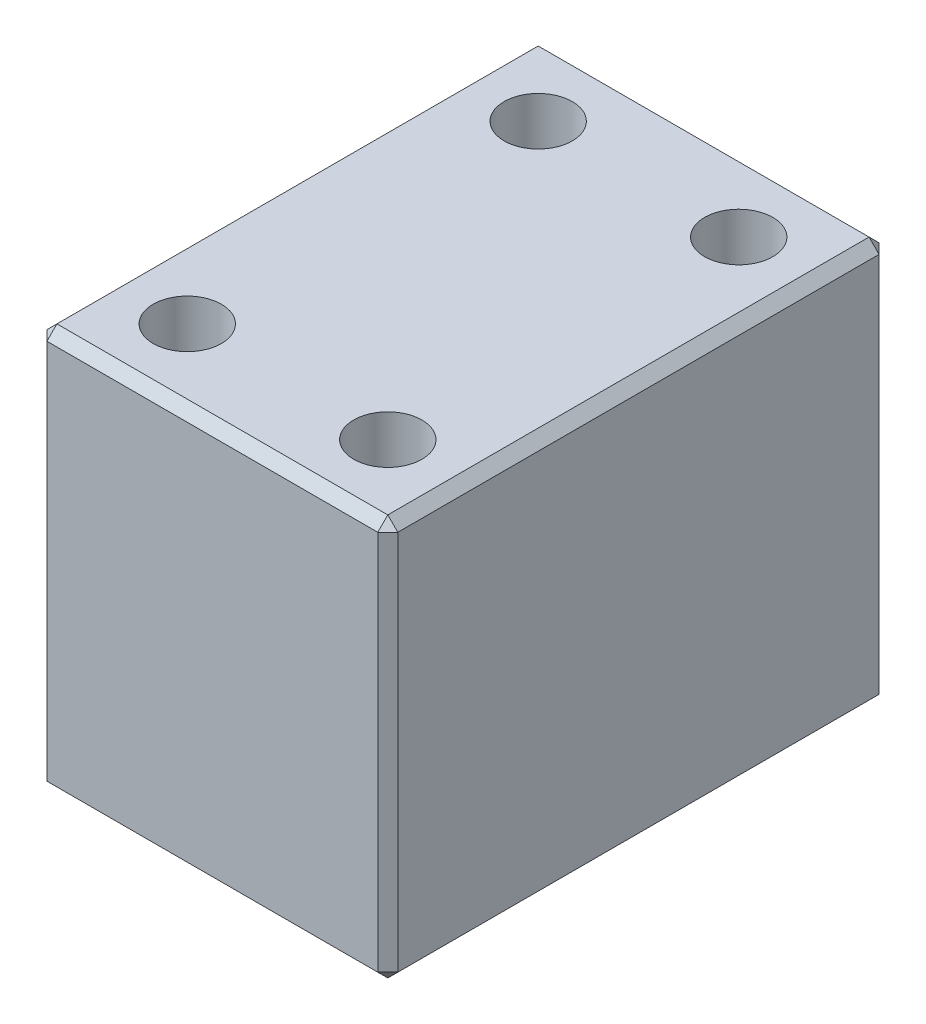
from build123d import *

# Parameters (mm, degrees)
SKETCH1_W                  = 35
SKETCH1_H                  = 50
BOSS_EXTRUDE1_DEPTH        = 40
CHAMFER1_SIZE              = 1
M8_TAPPED_HOLE1_AT_2_COUNT = 2
M8_TAPPED_HOLE1_AT_2_PITCH = 40.311288741


with BuildPart() as part:
    # Sketch1 → Boss-Extrude1 (new body)
    with BuildSketch(Plane(origin=(0, 0, 0), x_dir=(1, 0, 0), z_dir=(0, 1, 0))):
        Rectangle(SKETCH1_W, SKETCH1_H)
    extrude(amount=-BOSS_EXTRUDE1_DEPTH)

    # Chamfer1
    chamfer1_edges = [part.edges().sort_by_distance(p)[0] for p in [
        (-17.5, -40, 0),
        (0, -40, 25),
        (17.5, -40, 0),
        (0, 0, 25),
        (-17.5, 0, 0),
        (0, 0, -25),
        (17.5, 0, 0),
        (17.5, -20, 25),
        (-17.5, -20, 25),
        (-17.5, -20, -25),
        (17.5, -20, -25),
        (0, -40, -25),
    ]]
    chamfer(chamfer1_edges, length=CHAMFER1_SIZE)

    # Sketch3 → M8 Tapped Hole1 (revolve, cut)
    with BuildSketch(Plane(origin=(-10, 0, -17.5), x_dir=(0, 0, 1), z_dir=(1, 0, 0))):
        Polygon((0, 0), (0, 21.792926105), (3.4, 19.75), (3.4, 0), align=None)
    m8_tapped_hole1 = revolve(axis=Axis((-10, 6.35, -17.5), (0, -1, 0)), mode=Mode.SUBTRACT)

    # M8 Tapped Hole1 at 2: M8 Tapped Hole1 ×2
    with Locations(*[Vector(0.4961389383568339, 0, 0.8682431421244592) * (i * M8_TAPPED_HOLE1_AT_2_PITCH) for i in range(1, M8_TAPPED_HOLE1_AT_2_COUNT)]):
        add(m8_tapped_hole1, mode=Mode.SUBTRACT)

    # Mirror1: M8 Tapped Hole1 across plane
    add(m8_tapped_hole1.mirror(Plane.XY), mode=Mode.SUBTRACT)

    # Mirror1 copy 1 sketch → Mirror1 copy 1 (revolve, cut)
    with BuildSketch(Plane(origin=(10, 0, -17.5), x_dir=(0, 0, -1), z_dir=(1, 0, 0))):
        Polygon((0, 0), (0, -21.792926105), (3.4, -19.75), (3.4, 0), align=None)
    revolve(axis=Axis((10, 6.35, -17.5), (0, 1, 0)), mode=Mode.SUBTRACT)


solid = part.part
